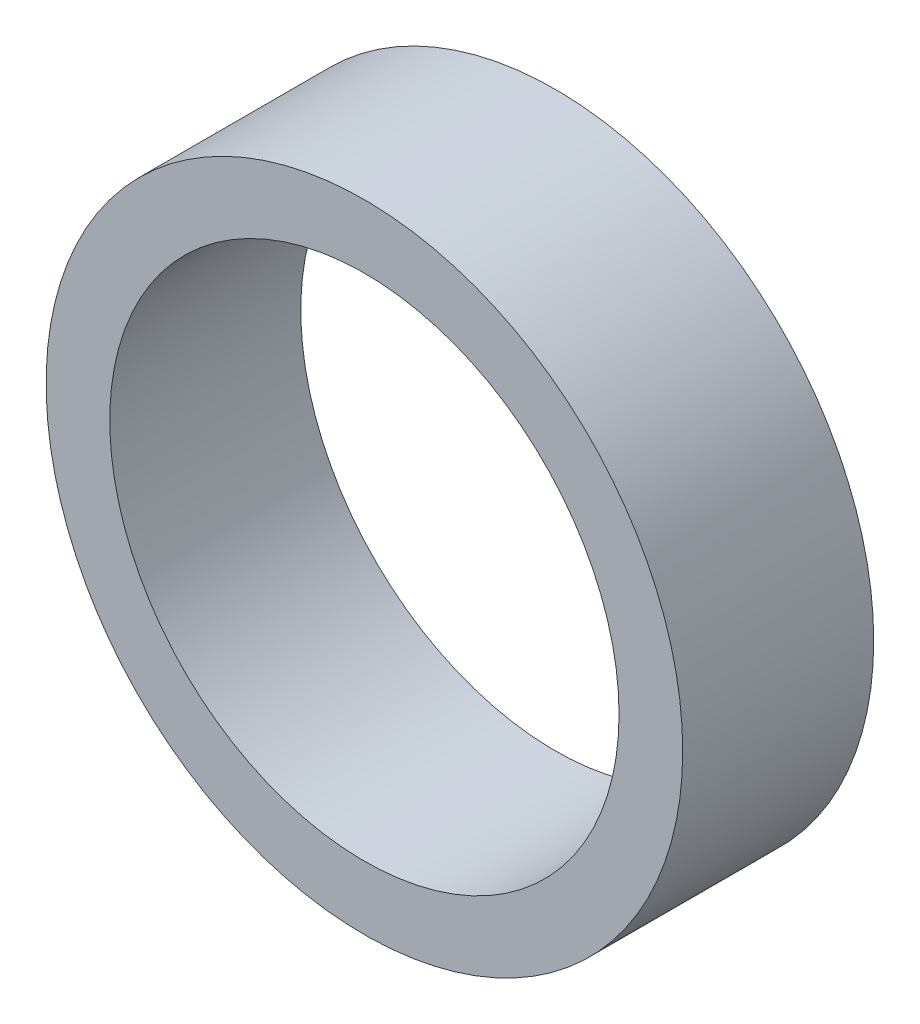
from build123d import *

# Parameters (mm, degrees)
SKETCH1_R           = 50
SKETCH1_R_2         = 40
BOSS_EXTRUDE1_DEPTH = 30


with BuildPart() as part:
    # Sketch1 → Boss-Extrude1 (new body)
    with BuildSketch(Plane.XY):
        Circle(SKETCH1_R)
        Circle(SKETCH1_R_2, mode=Mode.SUBTRACT)
    extrude(amount=BOSS_EXTRUDE1_DEPTH)


solid = part.part
